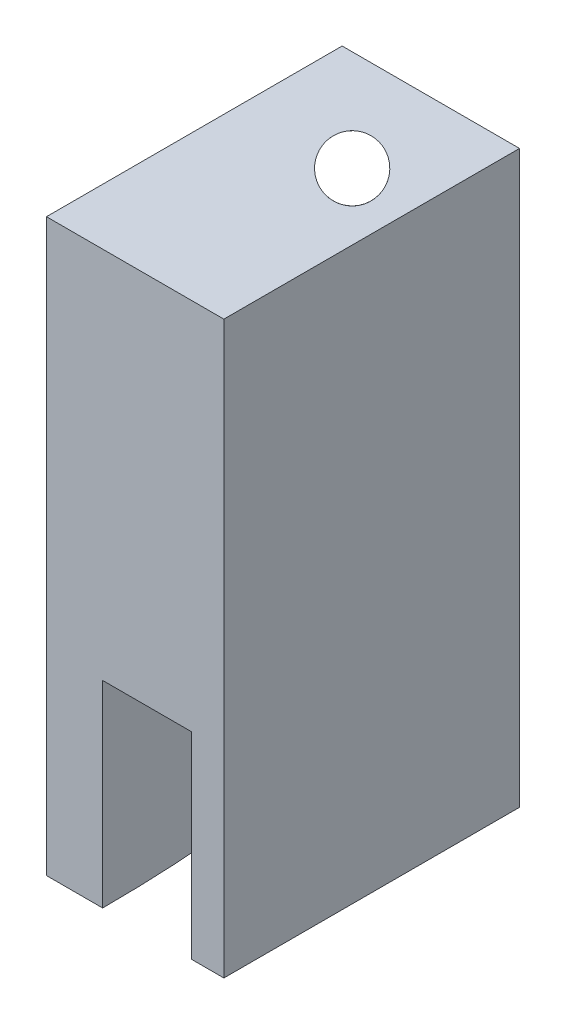
from build123d import *

# Parameters (mm, degrees)
SKETCH1_W           = 15
SKETCH1_H           = 25
BOSS_EXTRUDE1_DEPTH = 42
CUT_EXTRUDE1_DEPTH  = 16.666666667
SKETCH3_W           = 15
SKETCH3_H           = 25
BOSS_EXTRUDE2_DEPTH = 6.25
CUT_EXTRUDE2_REACH  = 136.927
SKETCH5_R           = 2.25


with BuildPart() as part:
    # Sketch1 → Boss-Extrude1 (new body)
    with BuildSketch(Plane(origin=(0, 0, 0), x_dir=(1, 0, 0), z_dir=(0, 1, 0))):
        with Locations((116, 12.5)):
            Rectangle(SKETCH1_W, SKETCH1_H)
    extrude(amount=BOSS_EXTRUDE1_DEPTH)

    # Sketch2 → Cut-Extrude1 (cut)
    with BuildSketch(Plane(origin=(0, 0, 0), x_dir=(1, 0, 0), z_dir=(0, 1, 0))):
        with BuildLine():
            Line((110.45615646, 25), (118.133663703, 25))
            ThreePointArc((118.133663703, 25), (120.094134728, 12.568265748), (120.75, 0))
            Line((120.75, 0), (113.25, 0))
            ThreePointArc((113.25, 0), (112.549371875, 12.57781342), (110.45615646, 25))
        make_face()
    extrude(amount=CUT_EXTRUDE1_DEPTH, mode=Mode.SUBTRACT)

    # Sketch3 → Boss-Extrude2 (add)
    with BuildSketch(Plane(origin=(0, 42, 0), x_dir=(1, 0, 0), z_dir=(0, 1, 0))):
        with Locations((116, 12.5)):
            Rectangle(SKETCH3_W, SKETCH3_H)
    extrude(amount=BOSS_EXTRUDE2_DEPTH)

    # Cut-Extrude2: up to this plane
    cut_extrude2_end = Plane(origin=(0, 48.25, 0), z_dir=(0, -1, 0))
    # Sketch5 → Cut-Extrude2 (cut, up to the surface)
    with BuildSketch(Plane(origin=(0, 0, 0), x_dir=(0.7071067811865464, 0, -0.7071067811865488), z_dir=(0.577381545199981, 0.5772877120855483, 0.577381545199979)), mode=Mode.PRIVATE) as cut_extrude2_sk1:
        with Locations(Location((95, -2, 0), (0, 0, 105.498899772))):
            Circle(SKETCH5_R)
    cut_extrude2_tool1 = split(extrude(cut_extrude2_sk1.sketch, amount=CUT_EXTRUDE2_REACH, mode=Mode.PRIVATE), bisect_by=cut_extrude2_end, keep=Keep.BOTH, mode=Mode.PRIVATE)
    add(cut_extrude2_tool1.solids().sort_by_distance((67.991552, -1.633082, -66.358736))[0], mode=Mode.SUBTRACT)


solid = part.part
